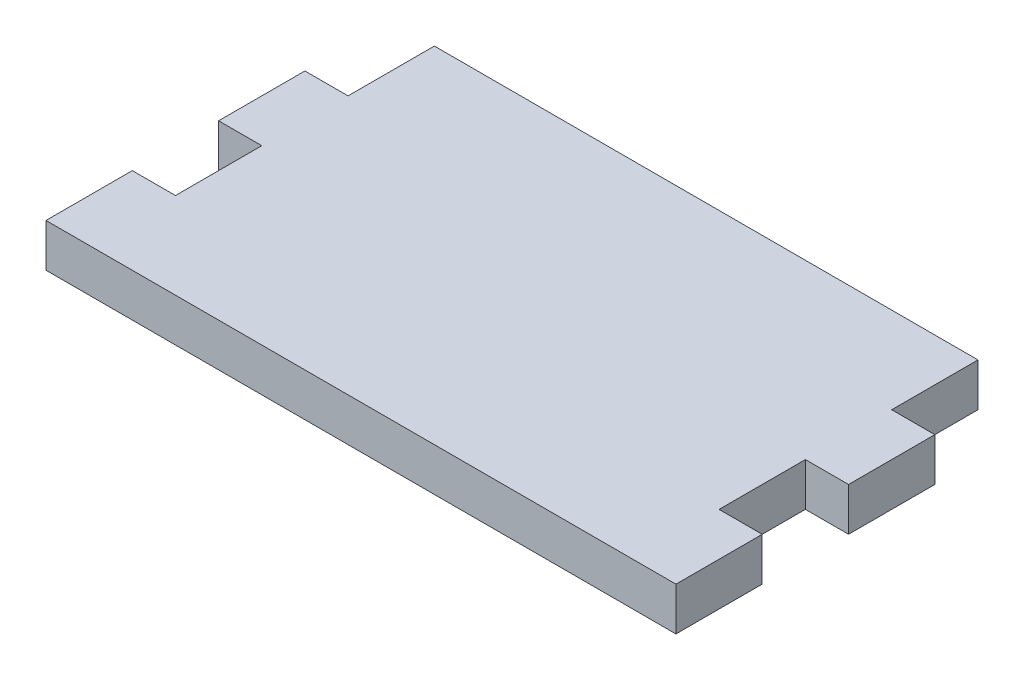
from build123d import *

# Parameters (mm, degrees)
BOSS_EXTRUDE1_DEPTH = 3.175


with BuildPart() as part:
    # Sketch1 → Boss-Extrude1 (new body)
    with BuildSketch(Plane(origin=(0, 0, 0), x_dir=(1, 0, 0), z_dir=(0, 1, 0))):
        Polygon((0, 0), (0, 6.35), (3.175, 6.35), (3.175, 12.7), (0, 12.7), (0, 19.05), (3.175, 19.05), (3.175, 25.4), (43.175, 25.4), (43.175, 19.05), (46.35, 19.05), (46.35, 12.7), (43.175, 12.7), (43.175, 6.35), (46.35, 6.35), (46.35, 0), align=None)
    extrude(amount=BOSS_EXTRUDE1_DEPTH)


solid = part.part
